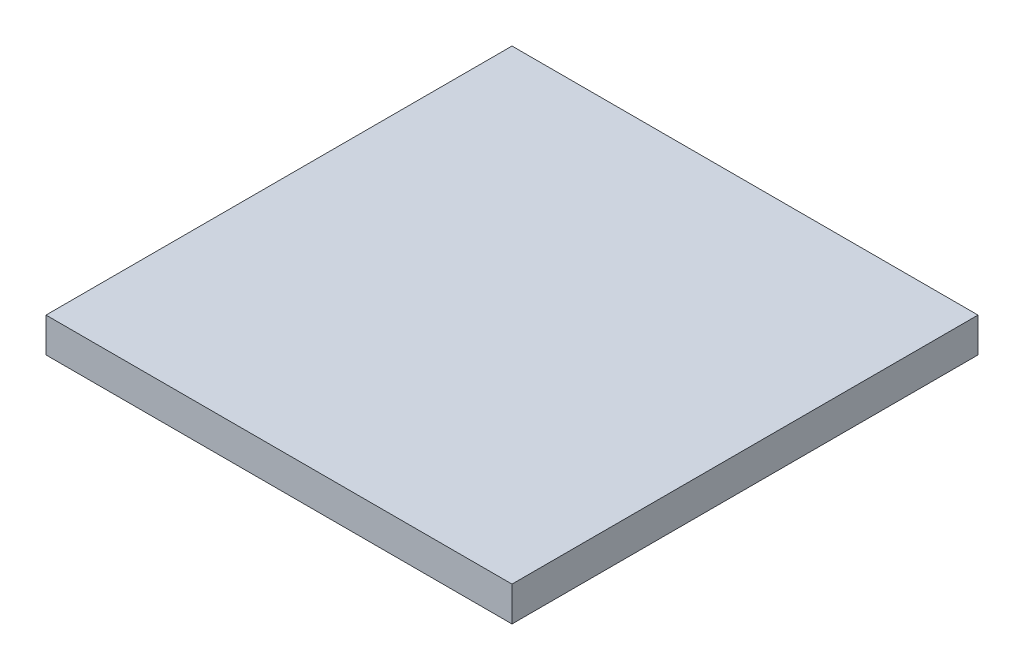
from build123d import *

# Parameters (mm, degrees)
SKETCH1_W           = 19.15
SKETCH1_H           = 19.15
BOSS_EXTRUDE1_DEPTH = 1.42


with BuildPart() as part:
    # Sketch1 → Boss-Extrude1 (new body)
    with BuildSketch(Plane(origin=(0, 0, 0), x_dir=(1, 0, 0), z_dir=(0, 1, 0))):
        Rectangle(SKETCH1_W, SKETCH1_H)
    extrude(amount=BOSS_EXTRUDE1_DEPTH)


solid = part.part
